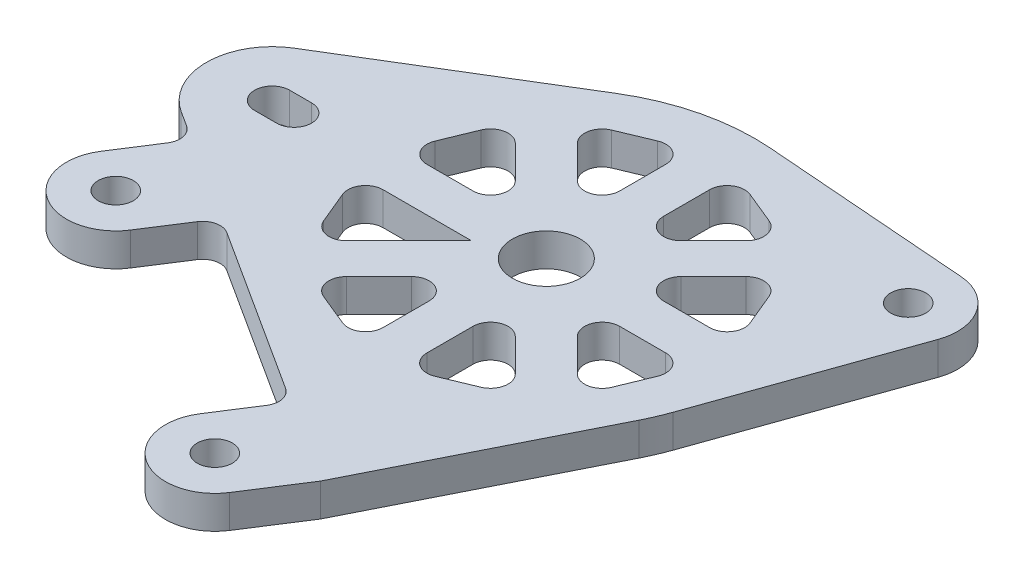
from build123d import *

# Parameters (mm, degrees)
SKETCH_1_R      = 1.6
SKETCH_1_R_2    = 3.1
EXTRUDE_1_DEPTH = 3
FILLET_1_R      = 1.6


with BuildPart() as part:
    # 草图1 → 凸台-拉伸1 (new body)
    with BuildSketch(Plane(origin=(0, 0, 0), x_dir=(1, 0, 0), z_dir=(0, 1, 0))):
        with BuildLine():
            Line((20.346167364, 17.486665594), (1.461595535, 18.943699177))
            ThreePointArc((1.461595535, 18.943699177), (-4.422619767, 18.478106894), (-9.88, 16.229158943))
            Line((-9.88, 16.229158943), (-28.12, 5.124997561))
            ThreePointArc((-28.12, 5.124997561), (-30.999566723, 0.072105046), (-28.242269316, -5.048533419))
            Line((-28.242269316, -5.048533419), (-25.544130748, -6.781332069))
            Line((-25.544130748, -6.781332069), (-28.786400064, -11.829865488))
            ThreePointArc((-28.786400064, -11.829865488), (-27.431701987, -18.047967539), (-21.213599936, -16.693269462))
            Line((-21.213599936, -16.693269462), (-17.97133062, -11.644736044))
            Line((-17.97133062, -11.644736044), (-0.301463654, -22.992678651))
            Line((-0.301463654, -22.992678651), (-3.543732971, -28.04121207))
            ThreePointArc((-3.543732971, -28.04121207), (-2.189034894, -34.259314121), (4.029067158, -32.904616044))
            Line((4.029067158, -32.904616044), (7.271336474, -27.856082626))
            Line((7.271336474, -27.856082626), (16.97889821, -8.527427253))
            ThreePointArc((16.97889821, -8.527427253), (17.476097582, -7.455602812), (17.905715537, -6.35494698))
            Line((17.905715537, -6.35494698), (24.240827364, 11.494880978))
            ThreePointArc((24.240827364, 11.494880978), (23.772996273, 15.452447578), (20.346167364, 17.486665594))
        make_face()
        Polygon((-12.211829252, -9.383402127), (-15.291662532, -2), (-4.828427125, -2), align=None, mode=Mode.SUBTRACT)
        Polygon((-15.270134549, 2), (-12.227051834, 9.398624709), (-4.828427125, 2), align=None, mode=Mode.SUBTRACT)
        Polygon((-9.383402127, 12.211829252), (-2, 15.291662532), (-2, 4.828427125), align=None, mode=Mode.SUBTRACT)
        Polygon((2, 15.270134549), (9.398624709, 12.227051834), (2, 4.828427125), align=None, mode=Mode.SUBTRACT)
        Polygon((12.211829252, 9.383402127), (15.291662532, 2), (4.828427125, 2), align=None, mode=Mode.SUBTRACT)
        Polygon((15.270134549, -2), (12.227051834, -9.398624709), (4.828427125, -2), align=None, mode=Mode.SUBTRACT)
        Polygon((9.383402127, -12.211829252), (2, -15.291662532), (2, -4.828427125), align=None, mode=Mode.SUBTRACT)
        Polygon((-2, -15.270134549), (-9.398624709, -12.227051834), (-2, -4.828427125), align=None, mode=Mode.SUBTRACT)
        with Locations(Location((20, 13, 0), (0, 0, 270))):
            Circle(SKETCH_1_R, mode=Mode.SUBTRACT)
        with BuildLine():
            Line((-25, 1.6), (-23, 1.6))
            ThreePointArc((-23, 1.6), (-21.4, 0), (-23, -1.6))
            Line((-23, -1.6), (-25, -1.6))
            ThreePointArc((-25, -1.6), (-26.6, 0), (-25, 1.6))
        make_face(mode=Mode.SUBTRACT)
        with Locations(Location((0.242667093, -30.472914057, 0), (0, 0, 270))):
            Circle(SKETCH_1_R, mode=Mode.SUBTRACT)
        with Locations(Location((-25, -14.261567475, 0), (0, 0, 270))):
            Circle(SKETCH_1_R, mode=Mode.SUBTRACT)
        with Locations(Location((0, 0, 0), (0, 0, 270))):
            Circle(SKETCH_1_R_2, mode=Mode.SUBTRACT)
    extrude(amount=EXTRUDE_1_DEPTH)

    # 圆角1
    fillet_1_edges = [part.edges().sort_by_distance(p)[0] for p in [
        (15.291662532, 1.5, -2),
        (12.211829252, 1.5, -9.383402127),
        (4.828427125, 1.5, -2),
        (9.398624709, 1.5, -12.227051834),
        (2, 1.5, -15.270134549),
        (2, 1.5, -4.828427125),
        (-2, 1.5, -15.291662532),
        (-9.383402127, 1.5, -12.211829252),
        (-2, 1.5, -4.828427125),
        (-12.227051834, 1.5, -9.398624709),
        (-15.270134549, 1.5, -2),
        (-4.828427125, 1.5, -2),
        (-15.291662532, 1.5, 2),
        (-12.211829252, 1.5, 9.383402127),
        (-9.398624709, 1.5, 12.227051834),
        (-2, 1.5, 15.270134549),
        (-2, 1.5, 4.828427125),
        (2, 1.5, 15.291662532),
        (9.383402127, 1.5, 12.211829252),
        (2, 1.5, 4.828427125),
        (12.227051834, 1.5, 9.398624709),
        (15.270134549, 1.5, 2),
        (4.828427125, 1.5, 2),
        (-0.301463654, 1.5, 22.992678651),
        (-17.97133062, 1.5, 11.644736044),
        (-25.544130748, 1.5, 6.781332069),
    ]]
    fillet(fillet_1_edges, radius=FILLET_1_R)


solid = part.part
